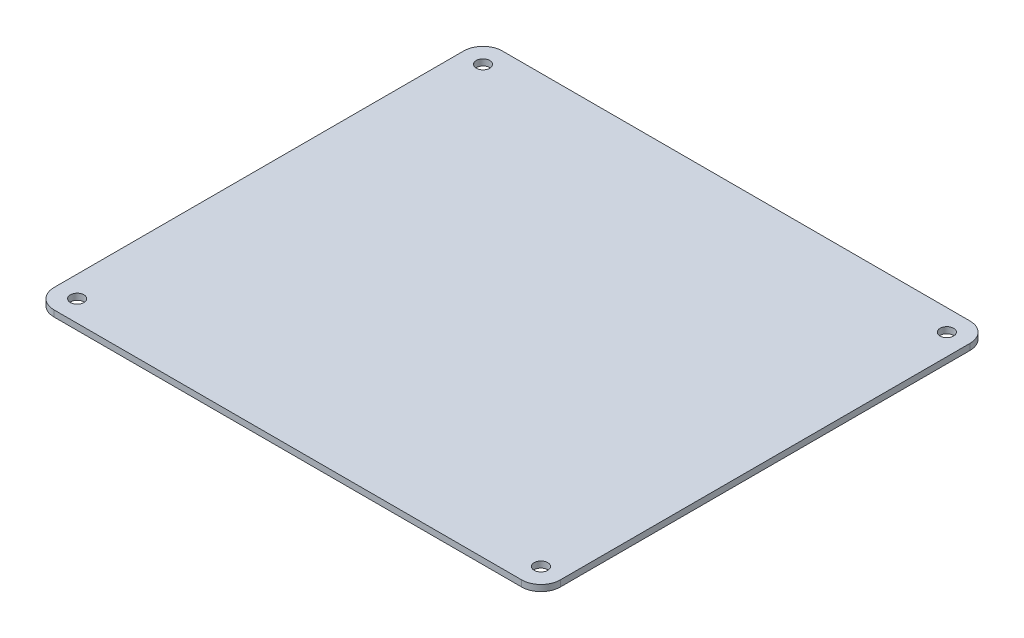
from build123d import *

# Parameters (mm, degrees)
ESQUISSE1_R        = 1.75
BOSS_EXTRU_1_DEPTH = 0.805


with BuildPart() as part:
    # Esquisse1 → Boss.-Extru.1 (new, symmetric)
    with BuildSketch(Plane(origin=(0, 0, 0), x_dir=(1, 0, 0), z_dir=(0, 1, 0))):
        with BuildLine():
            Line((-60.5, 58), (60.5, 58))
            ThreePointArc((60.5, 58), (64.035533906, 56.535533906), (65.5, 53))
            Line((65.5, 53), (65.5, -53))
            ThreePointArc((65.5, -53), (64.035533906, -56.535533906), (60.5, -58))
            Line((60.5, -58), (-60.5, -58))
            ThreePointArc((-60.5, -58), (-64.035533906, -56.535533906), (-65.5, -53))
            Line((-65.5, -53), (-65.5, 53))
            ThreePointArc((-65.5, 53), (-64.035533906, 56.535533906), (-60.5, 58))
        make_face()
        with Locations(Location((-60, 52.5, 0), (0, 0, 90))):
            Circle(ESQUISSE1_R, mode=Mode.SUBTRACT)
        with Locations(Location((60, 52.5, 0), (0, 0, 90))):
            Circle(ESQUISSE1_R, mode=Mode.SUBTRACT)
        with Locations(Location((60, -52.5, 0), (0, 0, 90))):
            Circle(ESQUISSE1_R, mode=Mode.SUBTRACT)
        with Locations(Location((-60, -52.5, 0), (0, 0, 90))):
            Circle(ESQUISSE1_R, mode=Mode.SUBTRACT)
    extrude(amount=BOSS_EXTRU_1_DEPTH, both=True)


solid = part.part
